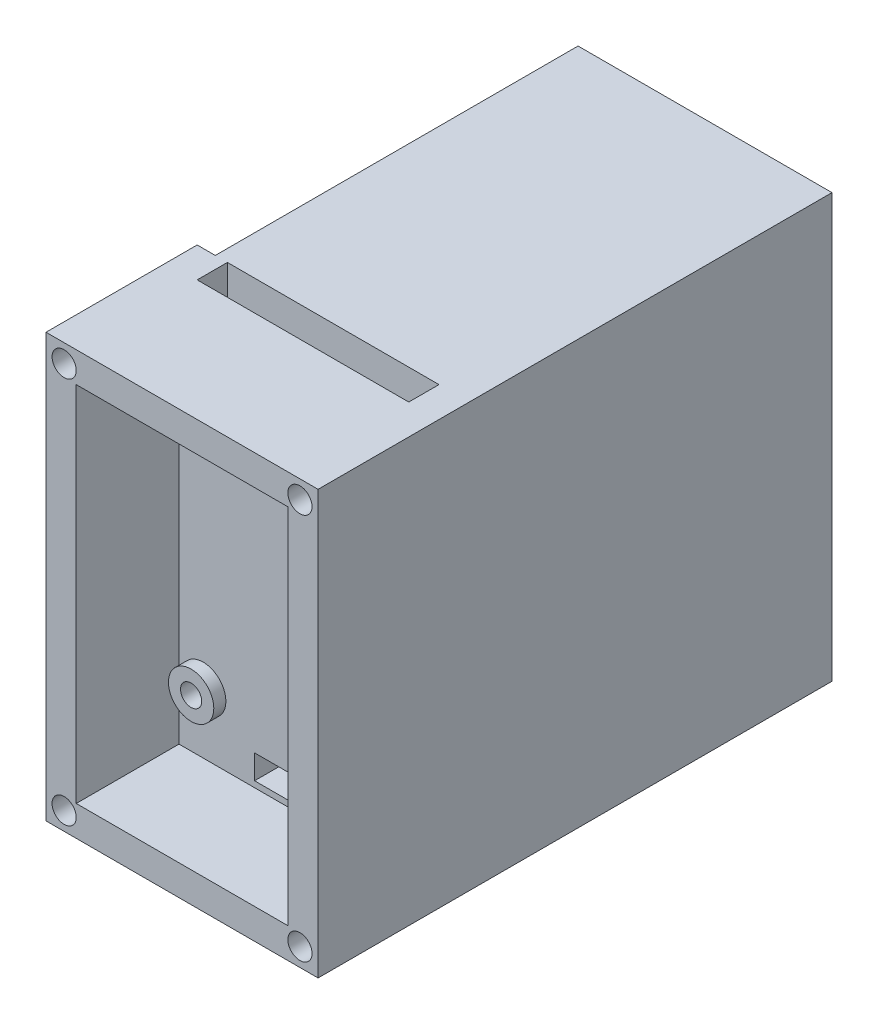
from build123d import *

# Parameters (mm, degrees)
SKICA1_W                    = 35
SKICA1_H                    = 60
P_IDAT_VYSUNUT_M1_DEPTH     = 3
SKICA3_W                    = 45
SKICA3_H                    = 70
SKICA3_W_2                  = 35
SKICA3_H_2                  = 60
VYSUNOUT_TENKOST_NN_1_DEPTH = 20
SKICA4_R                    = 3.75
SKICA4_R_2                  = 1.75
VYSUNOUT_TENKOST_NN_2_DEPTH = 2
ODEBRAT_START               = -1.5
SKICA5_R                    = 1.75
ODEBRAT_VYSUNUT_M1_DEPTH    = 1.5
SKICA10_W                   = 45
SKICA10_H                   = 70
P_IDAT_VYSUNUT_M2_DEPTH     = 5
SKICA12_W                   = 35
SKICA12_H                   = 50.840130339
ODEBRAT_VYSUNUT_M5_DEPTH    = 5
SKICA13_W                   = 45
SKICA13_H                   = 70
P_IDAT_VYSUNUT_M3_DEPTH     = 5
P_IDAT_VYSUNUT_M5_DEPTH     = 50
SKICA17_W                   = 45
SKICA17_H                   = 70
P_IDAT_VYSUNUT_M6_DEPTH     = 5
SKICA7_R                    = 2
ODEBRAT_VYSUNUT_M3_DEPTH    = 3.2
ODEBRAT_VYSUNUT_M6_REACH    = 104.22
SKICA8_W                    = 10
SKICA8_H                    = 4
SKICA21_W                   = 60
SKICA21_H                   = 70
ODEBRAT_VYSUNUT_M7_DEPTH    = 3
SKICA22_R                   = 1.75
ODEBRAT_VYSUNUT_M8_DEPTH    = 5
SKICA23_R                   = 5
ODEBRAT_VYSUNUT_M9_DEPTH    = 5


with BuildPart() as part:
    # Skica1 → Přidat vysunutím1 (new body)
    with BuildSketch(Plane.XY):
        with Locations((17.5, 30)):
            Rectangle(SKICA1_W, SKICA1_H)
    extrude(amount=P_IDAT_VYSUNUT_M1_DEPTH)

    # Skica3 → Vysunout tenkostěnný1 (add)
    with BuildSketch(Plane(origin=(0, 0, 0), x_dir=(-1, 0, 0), z_dir=(0, 0, -1))):
        with Locations((-17.5, 30)):
            Rectangle(SKICA3_W, SKICA3_H)
        with Locations((-17.5, 30)):
            Rectangle(SKICA3_W_2, SKICA3_H_2, mode=Mode.SUBTRACT)
    extrude(amount=-VYSUNOUT_TENKOST_NN_1_DEPTH)

    # Skica4 → Vysunout tenkostěnný2 (add)
    # profile 1 of 4: a face of its own
    with BuildSketch(Plane.XY.offset(3)):
        with Locations((4, 55)):
            Circle(SKICA4_R)
        with Locations((4, 55)):
            Circle(SKICA4_R_2, mode=Mode.SUBTRACT)
    # profile 2 of 4: a face of its own
    with BuildSketch(Plane.XY.offset(3)):
        with Locations((31, 55)):
            Circle(SKICA4_R)
        with Locations((31, 55)):
            Circle(SKICA4_R_2, mode=Mode.SUBTRACT)
    # profile 3 of 4: a face of its own
    with BuildSketch(Plane.XY.offset(3)):
        with Locations((31, 10)):
            Circle(SKICA4_R)
        with Locations((31, 10)):
            Circle(SKICA4_R_2, mode=Mode.SUBTRACT)
    # profile 4 of 4: a face of its own
    with BuildSketch(Plane.XY.offset(3)):
        with Locations((4, 10)):
            Circle(SKICA4_R)
        with Locations((4, 10)):
            Circle(SKICA4_R_2, mode=Mode.SUBTRACT)
    extrude(amount=VYSUNOUT_TENKOST_NN_2_DEPTH)

    # Skica5 → Odebrat vysunutím1 (cut)
    with BuildSketch(Plane.XY.offset(3).offset(ODEBRAT_START)):
        with Locations((4, 55)):
            Circle(SKICA5_R)
        with Locations((31, 55)):
            Circle(SKICA5_R)
        with Locations((31, 10)):
            Circle(SKICA5_R)
        with Locations((4, 10)):
            Circle(SKICA5_R)
    extrude(amount=ODEBRAT_VYSUNUT_M1_DEPTH, mode=Mode.SUBTRACT)

    # Skica10 → Přidat vysunutím2 (add)
    with BuildSketch(Plane(origin=(0, 0, 0), x_dir=(-1, 0, 0), z_dir=(0, 0, -1))):
        with Locations((-17.5, 30)):
            Rectangle(SKICA10_W, SKICA10_H)
    extrude(amount=P_IDAT_VYSUNUT_M2_DEPTH)

    # Skica12 → Odebrat vysunutím5 (cut)
    with BuildSketch(Plane(origin=(0, 0, -5), x_dir=(-1, 0, 0), z_dir=(0, 0, -1))):
        with Locations((-17.5, 39.579934831)):
            Rectangle(SKICA12_W, SKICA12_H)
    extrude(amount=-ODEBRAT_VYSUNUT_M5_DEPTH, mode=Mode.SUBTRACT)

    # Skica13 → Přidat vysunutím3 (add)
    with BuildSketch(Plane(origin=(0, 0, -5), x_dir=(-1, 0, 0), z_dir=(0, 0, -1))):
        with Locations((-17.5, 30)):
            Rectangle(SKICA13_W, SKICA13_H)
    extrude(amount=P_IDAT_VYSUNUT_M3_DEPTH)

    # Skica16 → Přidat vysunutím5 (add)
    with BuildSketch(Plane(origin=(0, 0, -10), x_dir=(-1, 0, 0), z_dir=(0, 0, -1))):
        Polygon((-37, -5), (5, -5), (5, 0), (-35, 0), (-35, 60), (5, 60), (5, 65), (-37, 65), (-40, 65), (-40, 62), (-40, -2), (-40, -5), align=None)
    extrude(amount=P_IDAT_VYSUNUT_M5_DEPTH)

    # Skica17 → Přidat vysunutím6 (add)
    with BuildSketch(Plane(origin=(0, 0, -60), x_dir=(-1, 0, 0), z_dir=(0, 0, -1))):
        with Locations((-17.5, 30)):
            Rectangle(SKICA17_W, SKICA17_H)
    extrude(amount=P_IDAT_VYSUNUT_M6_DEPTH)

    # Skica7 → Odebrat vysunutím3 (cut)
    with BuildSketch(Plane.XY.offset(20)):
        with Locations((37, 62)):
            Circle(SKICA7_R)
        with Locations((-2, 62)):
            Circle(SKICA7_R)
        with Locations((-2, -2)):
            Circle(SKICA7_R)
        with Locations((37, -2)):
            Circle(SKICA7_R)
    extrude(amount=-ODEBRAT_VYSUNUT_M3_DEPTH, mode=Mode.SUBTRACT)

    # Skica8 → Odebrat vysunutím6 (cut, up to next)
    with BuildSketch(Plane.XY.offset(3), mode=Mode.PRIVATE) as odebrat_vysunut_m6_sk1:
        with Locations((17.5, 3)):
            Rectangle(SKICA8_W, SKICA8_H)
    odebrat_vysunut_m6_tool1 = extrude(odebrat_vysunut_m6_sk1.sketch, amount=-ODEBRAT_VYSUNUT_M6_REACH, mode=Mode.PRIVATE) & part.part
    add(odebrat_vysunut_m6_tool1.solids().sort_by_distance((17.5, 3, 3))[0], mode=Mode.SUBTRACT)

    # Skica21 → Odebrat vysunutím7 (cut)
    with BuildSketch(Plane.ZY.offset(5)):
        with Locations((-35, 30)):
            Rectangle(SKICA21_W, SKICA21_H)
    extrude(amount=-ODEBRAT_VYSUNUT_M7_DEPTH, mode=Mode.SUBTRACT)

    # Skica22 → Odebrat vysunutím8 (cut)
    with BuildSketch(Plane.ZY.offset(2)):
        with Locations((-7.5, 62.5)):
            Circle(SKICA22_R)
        with Locations((-7.5, -2.5)):
            Circle(SKICA22_R)
        with Locations((-62.5, -2.5)):
            Circle(SKICA22_R)
        with Locations((-62.5, 62.5)):
            Circle(SKICA22_R)
    extrude(amount=-ODEBRAT_VYSUNUT_M8_DEPTH, mode=Mode.SUBTRACT)

    # Skica23 → Odebrat vysunutím9 (cut)
    with BuildSketch(Plane.XZ.offset(5)):
        with Locations(Location((14.5, -45.923378455, 0), (0, 0, 270))):
            Circle(SKICA23_R)
    extrude(amount=-ODEBRAT_VYSUNUT_M9_DEPTH, mode=Mode.SUBTRACT)


solid = part.part
